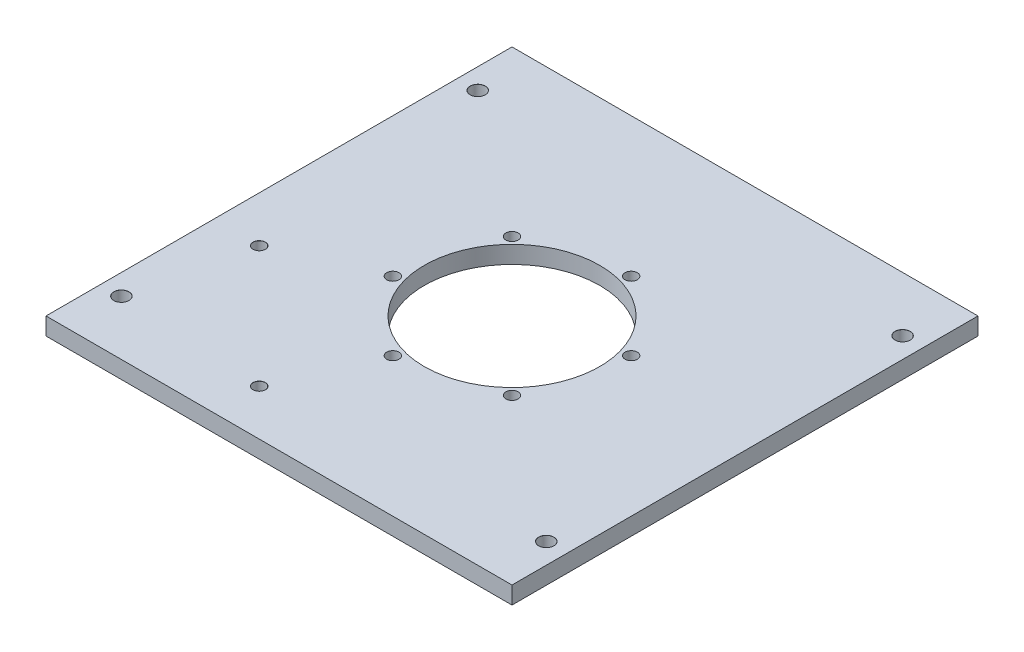
from build123d import *

# Parameters (mm, degrees)
SKETCH1_W                      = 170
SKETCH1_H                      = 170
SKETCH1_R                      = 32
BOSS_EXTRUDE3_DEPTH            = 6.35
M4_CLEARANCE_HOLE2_D           = 4.5
M4_CLEARANCE_HOLE2_CSINK_D     = 4.55
M4_CLEARANCE_HOLE2_CSINK_ANGLE = 90
M4_CLEARANCE_HOLE5_D           = 4.5
M4_CLEARANCE_HOLE5_CSINK_D     = 4.55
M4_CLEARANCE_HOLE5_CSINK_ANGLE = 90
M5_CLEARANCE_HOLE1_D           = 5.5
M5_CLEARANCE_HOLE1_CSINK_D     = 5.55
M5_CLEARANCE_HOLE1_CSINK_ANGLE = 90


with BuildPart() as part:
    # Sketch1 → Boss-Extrude3 (new body)
    with BuildSketch(Plane(origin=(0, 0, 0), x_dir=(1, 0, 0), z_dir=(0, 1, 0))):
        Rectangle(SKETCH1_W, SKETCH1_H)
        with Locations(Location((0, 0, 0), (0, 0, 270))):
            Circle(SKETCH1_R, mode=Mode.SUBTRACT)
    extrude(amount=BOSS_EXTRUDE3_DEPTH)

    # M4 Clearance Hole2 (through all)
    with Locations(Plane(origin=(0, 0, 0), x_dir=(-1, 0, 0), z_dir=(0, -1, 0))):
        with Locations((-9.188076101, 34.290366833), (25.102290732, 25.102290732), (34.290366833, -9.188076101), (9.188076101, -34.290366833), (-25.102290732, -25.102290732), (-34.290366833, 9.188076101)):
            CounterSinkHole(M4_CLEARANCE_HOLE2_D / 2, M4_CLEARANCE_HOLE2_CSINK_D / 2, counter_sink_angle=M4_CLEARANCE_HOLE2_CSINK_ANGLE)

    # M4 Clearance Hole5 (through all)
    with Locations(Plane(origin=(0, 6.35, 0), x_dir=(1, 0, 0), z_dir=(0, 1, 0))):
        with Locations((-68.301673362, -23.916580707), (-23.916580707, -68.301673362)):
            CounterSinkHole(M4_CLEARANCE_HOLE5_D / 2, M4_CLEARANCE_HOLE5_CSINK_D / 2, counter_sink_angle=M4_CLEARANCE_HOLE5_CSINK_ANGLE)

    # M5 Clearance Hole1 (through all)
    with Locations(Plane(origin=(0, 6.35, 0), x_dir=(1, 0, 0), z_dir=(0, 1, 0))):
        with Locations((-77.5, 65), (77.5, 65), (77.5, -65), (-77.5, -65)):
            CounterSinkHole(M5_CLEARANCE_HOLE1_D / 2, M5_CLEARANCE_HOLE1_CSINK_D / 2, counter_sink_angle=M5_CLEARANCE_HOLE1_CSINK_ANGLE)


solid = part.part
